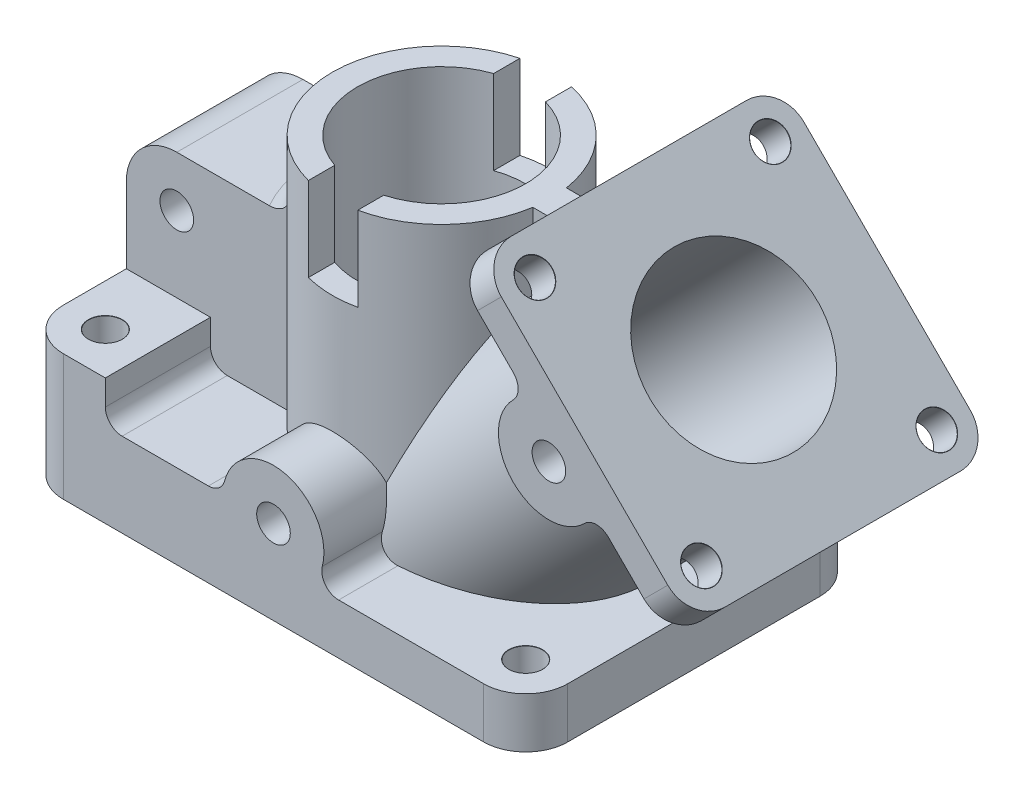
from build123d import *

# Parameters (mm, degrees)
SALIENTE_EXTRUIR1_DEPTH                   = 20
CROQUIS2_R                                = 2
CORTAR_EXTRUIR1_DEPTH                     = 74.86474125
REDONDEO1_R                               = 2
CROQUIS3_R                                = 13
SALIENTE_EXTRUIR2_DEPTH                   = 40
CROQUIS4_W                                = 19.765571405
CROQUIS4_H                                = 22.5
SALIENTE_EXTRUIR3_DEPTH                   = 7.5
REDONDEO2_R                               = 2
REDONDEO3_R                               = 6
CROQUIS8_W                                = 36
CROQUIS8_H                                = 36
SALIENTE_EXTRUIR4_DEPTH                   = 4
CROQUIS9_R                                = 13
SALIENTE_EXTRUIR5_DEPTH                   = 41
CROQUIS10_R                               = 6
CROQUIS10_R_2                             = 2
SALIENTE_EXTRUIR6_DEPTH                   = 36
REDONDEO4_R                               = 2
REDONDEO5_R                               = 5
REDONDEO6_R                               = 4
F_4_0MM_DOWEL_HOLE1_D                     = 4
F_4_0MM_DOWEL_HOLE1_DEPTH                 = 15
F_4_0MM_DOWEL_HOLE1_CSINK_D               = 4.05
F_4_0MM_DOWEL_HOLE1_CSINK_ANGLE           = 100
F_4_0MM_DOWEL_HOLE1_TIP                   = 1.201721238
F_4_0MM_DOWEL_HOLE1_ON_FACE_2_D           = 4
F_4_0MM_DOWEL_HOLE1_ON_FACE_2_DEPTH       = 15
F_4_0MM_DOWEL_HOLE1_ON_FACE_2_CSINK_D     = 4.05
F_4_0MM_DOWEL_HOLE1_ON_FACE_2_CSINK_ANGLE = 100
F_4_0MM_DOWEL_HOLE1_ON_FACE_2_TIP         = 1.201721238
F_4_0MM_DOWEL_HOLE1_ON_FACE_3_D           = 4
F_4_0MM_DOWEL_HOLE1_ON_FACE_3_DEPTH       = 15
F_4_0MM_DOWEL_HOLE1_ON_FACE_3_CSINK_D     = 4.05
F_4_0MM_DOWEL_HOLE1_ON_FACE_3_CSINK_ANGLE = 100
F_4_0MM_DOWEL_HOLE1_ON_FACE_3_TIP         = 1.201721238
F_4_0MM_DOWEL_HOLE1_ON_FACE_4_D           = 4
F_4_0MM_DOWEL_HOLE1_ON_FACE_4_DEPTH       = 15
F_4_0MM_DOWEL_HOLE1_ON_FACE_4_CSINK_D     = 4.05
F_4_0MM_DOWEL_HOLE1_ON_FACE_4_CSINK_ANGLE = 100
F_4_0MM_DOWEL_HOLE1_ON_FACE_4_TIP         = 1.201721238
CROQUIS15_W                               = 19.132779789
CROQUIS15_H                               = 11.873328498
SALIENTE_EXTRUIR13_DEPTH                  = 2
CROQUIS20_R                               = 10
CORTAR_EXTRUIR3_DEPTH                     = 92.139824083
CROQUIS21_R                               = 10
CORTAR_EXTRUIR4_DEPTH                     = 76.686940746
CROQUIS22_W                               = 6
CROQUIS22_H                               = 10
CORTAR_EXTRUIR5_DEPTH                     = 15
CROQUIS23_R                               = 2
CORTAR_EXTRUIR6_DEPTH                     = 96.267173873


with BuildPart() as part:
    # Croquis1 → Saliente-Extruir1 (new, symmetric)
    with BuildSketch(Plane.XY):
        with BuildLine():
            Line((0, 0), (0, 15))
            Line((0, 15), (10, 15))
            Line((10, 15), (10, 10))
            Line((10, 10), (24, 10))
            ThreePointArc((24, 10), (32.140932539, 15.605034154), (34.472135955, 6))
            Line((34.472135955, 6), (60, 6))
            Line((60, 6), (60, 0))
            Line((60, 0), (0, 0))
        make_face()
    extrude(amount=SALIENTE_EXTRUIR1_DEPTH, both=True)

    # Croquis2 → Cortar-Extruir1 (cut, through all)
    with BuildSketch(Plane.XY.offset(20)):
        with Locations((30, 10)):
            Circle(CROQUIS2_R)
    extrude(amount=-CORTAR_EXTRUIR1_DEPTH, mode=Mode.SUBTRACT)

    # Redondeo1
    redondeo1_edges = [part.edges().sort_by_distance(p)[0] for p in [
        (10, 10, 0),
        (24, 10, 0),
        (34.472135955, 6, 0),
    ]]
    fillet(redondeo1_edges, radius=REDONDEO1_R)

    # Croquis3 → Saliente-Extruir2 (add)
    with BuildSketch(Plane.XZ):
        with Locations((30, 0)):
            Circle(CROQUIS3_R)
    extrude(amount=-SALIENTE_EXTRUIR2_DEPTH)

    # Croquis4 → Saliente-Extruir3 (add, symmetric)
    with BuildSketch(Plane.XY):
        with Locations((9.882785703, 18.75)):
            Rectangle(CROQUIS4_W, CROQUIS4_H)
    extrude(amount=SALIENTE_EXTRUIR3_DEPTH, both=True)

    # Redondeo2
    redondeo2_edges = [part.edges().sort_by_distance(p)[0] for p in [
        (17, 30, 0),
    ]]
    fillet(redondeo2_edges, radius=REDONDEO2_R)

    # Redondeo3
    redondeo3_edges = [part.edges().sort_by_distance(p)[0] for p in [
        (0, 30, 0),
    ]]
    fillet(redondeo3_edges, radius=REDONDEO3_R)



with BuildPart() as body_2:
    # Croquis8 → Saliente-Extruir4 (new body)
    with BuildSketch(Plane(origin=(65, 35, 0), x_dir=(0.7071067811865517, -0.7071067811865434, 0), z_dir=(0.7071067811865434, 0.7071067811865517, 0))):
        Rectangle(CROQUIS8_W, CROQUIS8_H)
    extrude(amount=-SALIENTE_EXTRUIR4_DEPTH)


with BuildPart() as part_1:
    add(part.part)

    add(body_2.part)  # Saliente-Extruir5 merges body 2
    # Croquis9 → Saliente-Extruir5 (add)
    with BuildSketch(Plane(origin=(50, 50, 0), x_dir=(0, 0, -1), z_dir=(0.7071067811865435, 0.7071067811865517, 0))):
        with Locations(Location((0, -21.213203436, 0), (0, 0, 90))):
            Circle(CROQUIS9_R)
    extrude(amount=-SALIENTE_EXTRUIR5_DEPTH)

    # Croquis10 → Saliente-Extruir6 (add)
    with BuildSketch(Plane.XY.offset(18)):
        with Locations((60.757359313, 30.757359313)):
            Circle(CROQUIS10_R)
        with Locations((60.757359313, 30.757359313)):
            Circle(CROQUIS10_R_2, mode=Mode.SUBTRACT)
    extrude(amount=-SALIENTE_EXTRUIR6_DEPTH)

    # Redondeo4
    redondeo4_edges = [part_1.edges().sort_by_distance(p)[0] for p in [
        (66.171572875, 28.171572875, -14.852349955),
        (58.171572875, 36.171572875, -14.852349955),
        (66.171572875, 28.171572875, 14.852349955),
        (58.171572875, 36.171572875, 14.852349955),
    ]]
    fillet(redondeo4_edges, radius=REDONDEO4_R)

    # Redondeo5
    redondeo5_edges = [part_1.edges().sort_by_distance(p)[0] for p in [
        (60, 3, -20),
        (0, 7.5, 20),
        (0, 7.5, -20),
        (60, 3, 20),
    ]]
    fillet(redondeo5_edges, radius=REDONDEO5_R)

    # Redondeo6
    redondeo6_edges = [part_1.edges().sort_by_distance(p)[0] for p in [
        (50.857864376, 46.313708499, 18),
        (50.857864376, 46.313708499, -18),
        (76.313708499, 20.857864376, -18),
        (76.313708499, 20.857864376, 18),
    ]]
    fillet(redondeo6_edges, radius=REDONDEO6_R)

    # Ø4.0mm Dowel Hole1
    with Locations(Plane(origin=(55.100505063, 44.899494937, 14), x_dir=(0.707106781187, -0.707106781187, 0), z_dir=(0.707106781187, 0.707106781187, 0))):
        with Locations((1e-09, 0)):
            CounterSinkHole(F_4_0MM_DOWEL_HOLE1_D / 2, F_4_0MM_DOWEL_HOLE1_CSINK_D / 2, depth=F_4_0MM_DOWEL_HOLE1_DEPTH, counter_sink_angle=F_4_0MM_DOWEL_HOLE1_CSINK_ANGLE)
            with Locations((0, 0, -(F_4_0MM_DOWEL_HOLE1_DEPTH + F_4_0MM_DOWEL_HOLE1_TIP / 2))):  # 118° drill point
                Cone(0, F_4_0MM_DOWEL_HOLE1_D / 2, F_4_0MM_DOWEL_HOLE1_TIP, mode=Mode.SUBTRACT)

    # Ø4.0mm Dowel Hole1 on face 2
    with Locations(Plane(origin=(55.100505063, 44.899494937, -14), x_dir=(0.707106781187, -0.707106781187, 0), z_dir=(0.707106781187, 0.707106781187, 0))):
        with Locations((1e-09, 0), (28.000000001, 0), (28.000000001, -28)):
            CounterSinkHole(F_4_0MM_DOWEL_HOLE1_ON_FACE_2_D / 2, F_4_0MM_DOWEL_HOLE1_ON_FACE_2_CSINK_D / 2, depth=F_4_0MM_DOWEL_HOLE1_ON_FACE_2_DEPTH, counter_sink_angle=F_4_0MM_DOWEL_HOLE1_ON_FACE_2_CSINK_ANGLE)
            with Locations((0, 0, -(F_4_0MM_DOWEL_HOLE1_ON_FACE_2_DEPTH + F_4_0MM_DOWEL_HOLE1_ON_FACE_2_TIP / 2))):  # 118° drill point
                Cone(0, F_4_0MM_DOWEL_HOLE1_ON_FACE_2_D / 2, F_4_0MM_DOWEL_HOLE1_ON_FACE_2_TIP, mode=Mode.SUBTRACT)

    # Ø4.0mm Dowel Hole1 on face 3
    with Locations(Plane(origin=(55, 6, 15), x_dir=(0, 0, 1), z_dir=(0, 1, 0))):
        with Locations((0, 0), (-30, 0)):
            CounterSinkHole(F_4_0MM_DOWEL_HOLE1_ON_FACE_3_D / 2, F_4_0MM_DOWEL_HOLE1_ON_FACE_3_CSINK_D / 2, depth=F_4_0MM_DOWEL_HOLE1_ON_FACE_3_DEPTH, counter_sink_angle=F_4_0MM_DOWEL_HOLE1_ON_FACE_3_CSINK_ANGLE)
            with Locations((0, 0, -(F_4_0MM_DOWEL_HOLE1_ON_FACE_3_DEPTH + F_4_0MM_DOWEL_HOLE1_ON_FACE_3_TIP / 2))):  # 118° drill point
                Cone(0, F_4_0MM_DOWEL_HOLE1_ON_FACE_3_D / 2, F_4_0MM_DOWEL_HOLE1_ON_FACE_3_TIP, mode=Mode.SUBTRACT)

    # Ø4.0mm Dowel Hole1 on face 4
    with Locations(Plane(origin=(5, 15, -15), x_dir=(0, 0, 1), z_dir=(0, 1, 0))):
        with Locations((0, 0), (30, 0)):
            CounterSinkHole(F_4_0MM_DOWEL_HOLE1_ON_FACE_4_D / 2, F_4_0MM_DOWEL_HOLE1_ON_FACE_4_CSINK_D / 2, depth=F_4_0MM_DOWEL_HOLE1_ON_FACE_4_DEPTH, counter_sink_angle=F_4_0MM_DOWEL_HOLE1_ON_FACE_4_CSINK_ANGLE)
            with Locations((0, 0, -(F_4_0MM_DOWEL_HOLE1_ON_FACE_4_DEPTH + F_4_0MM_DOWEL_HOLE1_ON_FACE_4_TIP / 2))):  # 118° drill point
                Cone(0, F_4_0MM_DOWEL_HOLE1_ON_FACE_4_D / 2, F_4_0MM_DOWEL_HOLE1_ON_FACE_4_TIP, mode=Mode.SUBTRACT)

    # Croquis15 → Saliente-Extruir13 (add, symmetric)
    with BuildSketch(Plane.XY):
        with Locations((43.783174249, 34.063335751)):
            Rectangle(CROQUIS15_W, CROQUIS15_H)
    extrude(amount=SALIENTE_EXTRUIR13_DEPTH, both=True)

    # Croquis20 → Cortar-Extruir3 (cut, through all)
    with BuildSketch(Plane(origin=(0, 40, 0), x_dir=(1, 0, 0), z_dir=(0, 1, 0))):
        with Locations(Location((30, 0, 0), (0, 0, 180))):
            Circle(CROQUIS20_R)
    extrude(amount=-CORTAR_EXTRUIR3_DEPTH, mode=Mode.SUBTRACT)

    # Croquis21 → Cortar-Extruir4 (cut, through all)
    with BuildSketch(Plane(origin=(50, 50, 0), x_dir=(0, 0, -1), z_dir=(0.7071067811865435, 0.7071067811865516, 0))):
        with Locations(Location((0, -20.834677082, 0), (0, 0, 90))):
            Circle(CROQUIS21_R)
    extrude(amount=-CORTAR_EXTRUIR4_DEPTH, mode=Mode.SUBTRACT)

    # Croquis22 → Cortar-Extruir5 (cut, symmetric)
    with BuildSketch(Plane.XY):
        with Locations((29.733741592, 35)):
            Rectangle(CROQUIS22_W, CROQUIS22_H)
    extrude(amount=CORTAR_EXTRUIR5_DEPTH, both=True, mode=Mode.SUBTRACT)

    # Croquis23 → Cortar-Extruir6 (cut, through all)
    with BuildSketch(Plane.XY.offset(7.5)):
        with Locations((6, 24)):
            Circle(CROQUIS23_R)
    extrude(amount=-CORTAR_EXTRUIR6_DEPTH, mode=Mode.SUBTRACT)


solid = part_1.part
